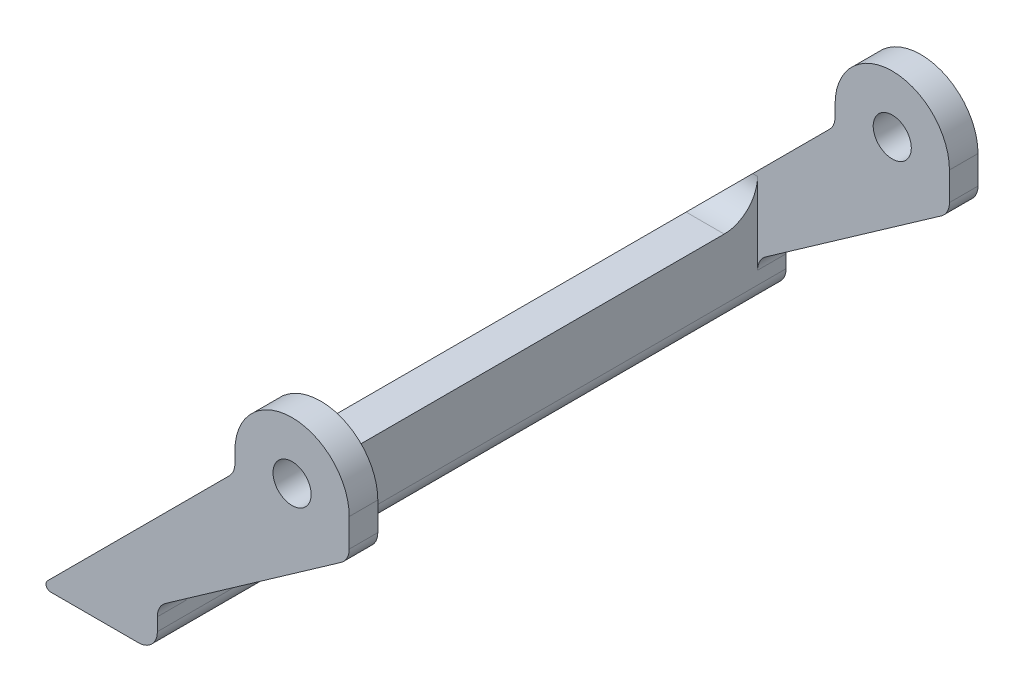
from build123d import *

# Parameters (mm, degrees)
EXTRUDE1_DEPTH = 3
EXTRUDE2_DEPTH = 66
EXTRUDE3_START = -3
EXTRUDE3_DEPTH = 3
SKETCH2_R      = 2
EXTRUDE4_DEPTH = 3
EXTRUDE5_START = -3
SKETCH6_R      = 2
EXTRUDE5_DEPTH = 3
FILLET3_R      = 3.5
FILLET6_R      = 2
FILLET7_R      = 0.5
FILLET13_R     = 2


with BuildPart() as part:
    # Sketch1 → Extrude1 (new body)
    with BuildSketch(Plane.XY):
        with BuildLine():
            Line((-14.803266257, -5.201299994), (-2.663266257, 6.938700006))
            Line((-2.663266257, 6.938700006), (-2.663266257, 8.94083563))
            ThreePointArc((-2.663266257, 8.94083563), (3.336733743, 14.94083563), (9.336733743, 8.94083563))
            Line((9.336733743, 8.94083563), (9.336733743, 4.94083563))
            Line((9.336733743, 4.94083563), (-10.803266257, -9.201299994))
            Line((-10.803266257, -9.201299994), (-10.803266257, -5.201299994))
            Line((-10.803266257, -5.201299994), (-14.803266257, -5.201299994))
        make_face()
    extrude(amount=EXTRUDE1_DEPTH)

    # Sketch3 → Extrude2 (add)
    with BuildSketch(Plane.XY):
        Polygon((-14.803266257, -5.201299994), (-10.803266257, -5.201299994), (-10.803266257, -13.596193084), (-23.198159347, -13.596193084), align=None)
    extrude(amount=EXTRUDE2_DEPTH)

    # Sketch4 → Extrude3 (add)
    with BuildSketch(Plane.XY.offset(66).offset(EXTRUDE3_START)):
        with BuildLine():
            Line((-14.803266257, -5.201299994), (-10.803266257, -5.201299994))
            Line((-10.803266257, -5.201299994), (-10.803266257, -9.201299994))
            Line((-10.803266257, -9.201299994), (9.336733743, 4.94083563))
            Line((9.336733743, 4.94083563), (9.336733743, 8.94083563))
            ThreePointArc((9.336733743, 8.94083563), (3.336733743, 14.94083563), (-2.663266257, 8.94083563))
            Line((-2.663266257, 8.94083563), (-2.663266257, 6.938700006))
            Line((-2.663266257, 6.938700006), (-14.803266257, -5.201299994))
        make_face()
    extrude(amount=EXTRUDE3_DEPTH)

    # Sketch2 → Extrude4 (cut)
    with BuildSketch(Plane.XY.offset(3)):
        with Locations((3.336733743, 8.94083563)):
            Circle(SKETCH2_R)
    extrude(amount=-EXTRUDE4_DEPTH, mode=Mode.SUBTRACT)

    # Sketch6 → Extrude5 (cut)
    with BuildSketch(Plane(origin=(0, 0, 63), x_dir=(-1, 0, 0), z_dir=(0, 0, -1)).offset(EXTRUDE5_START)):
        with Locations(Location((-3.336733743, 8.94083563, 0), (0, 0, 180))):
            Circle(SKETCH6_R)
    extrude(amount=EXTRUDE5_DEPTH, mode=Mode.SUBTRACT)

    # Fillet3
    fillet3_edges = [part.edges().sort_by_distance(p)[0] for p in [
        (-12.803266257, -5.201299994, 3),
        (-12.803266257, -5.201299994, 63),
    ]]
    fillet(fillet3_edges, radius=FILLET3_R)

    # Fillet6
    fillet6_edges = [part.edges().sort_by_distance(p)[0] for p in [
        (9.336733743, 4.94083563, 1.5),
        (-2.663266257, 6.938700006, 1.5),
        (-2.663266257, 6.938700006, 64.5),
        (9.336733743, 4.94083563, 64.5),
    ]]
    fillet(fillet6_edges, radius=FILLET6_R)

    # Fillet7
    fillet7_edges = [part.edges().sort_by_distance(p)[0] for p in [
        (-23.198159347, -13.596193084, 33),
    ]]
    fillet(fillet7_edges, radius=FILLET7_R)

    # Fillet13
    fillet13_edges = [part.edges().sort_by_distance(p)[0] for p in [
        (-10.803266257, -9.201299994, 1.5),
        (-10.803266257, -13.596193084, 33),
        (-10.803266257, -9.201299994, 64.5),
    ]]
    fillet(fillet13_edges, radius=FILLET13_R)


solid = part.part
